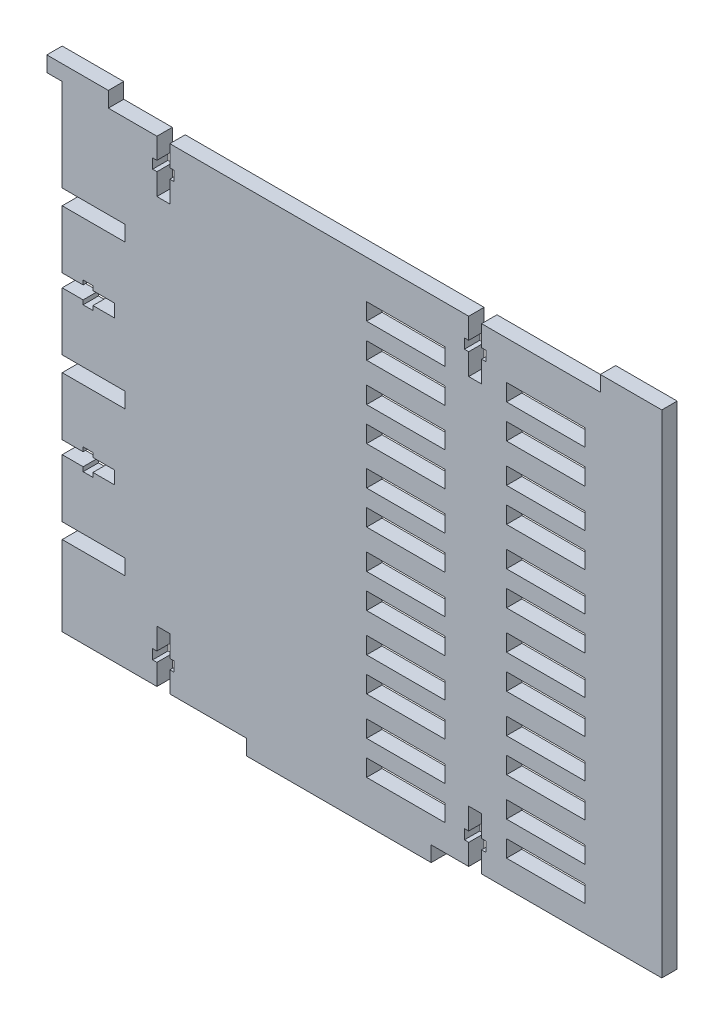
from build123d import *

# Parameters (mm, degrees)
SKETCH1_W           = 25.5
SKETCH1_H           = 5.5
BOSS_EXTRUDE1_DEPTH = 5
CUT_EXTRUDE1_DEPTH  = 10
SKETCH5_W           = 60
SKETCH5_H           = 5
BOSS_EXTRUDE2_DEPTH = 5
SKETCH6_W           = 20.4
SKETCH6_H           = 5
CUT_EXTRUDE2_DEPTH  = 10


with BuildPart() as part:
    # Sketch1 → Boss-Extrude1 (new body)
    with BuildSketch(Plane.XY):
        Polygon((-155, 151.5), (-155, 146.5), (5, 146.5), (5, 151.5), (25, 151.5), (25, -8.5), (-170, -8.5), (-170, 17.5), (-150, 17.5), (-150, 22.5), (-170, 22.5), (-170, 41), (-170, 41.4), (-163.2, 41.4), (-163.2, 40), (-160, 40), (-160, 41.4), (-153, 41.4), (-153, 45.6), (-160, 45.6), (-160, 47), (-163.2, 47), (-163.2, 45.6), (-170, 45.6), (-170, 46), (-170, 64.5), (-150, 64.5), (-150, 69.5), (-170, 69.5), (-170, 88.4), (-163.2, 88.4), (-163.2, 87), (-160, 87), (-160, 88.4), (-153, 88.4), (-153, 92.6), (-160, 92.6), (-160, 94), (-163.2, 94), (-163.2, 92.6), (-170, 92.6), (-170, 111.5), (-150, 111.5), (-150, 116.5), (-170, 116.5), (-170, 146.5), (-175, 146.5), (-175, 151.5), align=None)
        with Locations((-58.25, 13.75)):
            Rectangle(SKETCH1_W, SKETCH1_H, mode=Mode.SUBTRACT)
        with Locations((-12.75, 2.75)):
            Rectangle(SKETCH1_W, SKETCH1_H, mode=Mode.SUBTRACT)
        with Locations((-58.25, 2.75)):
            Rectangle(SKETCH1_W, SKETCH1_H, mode=Mode.SUBTRACT)
        with Locations((-12.75, 13.75)):
            Rectangle(SKETCH1_W, SKETCH1_H, mode=Mode.SUBTRACT)
        with Locations((-12.75, 26.25)):
            Rectangle(SKETCH1_W, SKETCH1_H, mode=Mode.SUBTRACT)
        with Locations((-58.25, 26.25)):
            Rectangle(SKETCH1_W, SKETCH1_H, mode=Mode.SUBTRACT)
        with Locations((-58.25, 37.25)):
            Rectangle(SKETCH1_W, SKETCH1_H, mode=Mode.SUBTRACT)
        with Locations((-12.75, 37.25)):
            Rectangle(SKETCH1_W, SKETCH1_H, mode=Mode.SUBTRACT)
        with Locations((-12.75, 49.75)):
            Rectangle(SKETCH1_W, SKETCH1_H, mode=Mode.SUBTRACT)
        with Locations((-58.25, 49.75)):
            Rectangle(SKETCH1_W, SKETCH1_H, mode=Mode.SUBTRACT)
        with Locations((-58.25, 60.75)):
            Rectangle(SKETCH1_W, SKETCH1_H, mode=Mode.SUBTRACT)
        with Locations((-12.75, 60.75)):
            Rectangle(SKETCH1_W, SKETCH1_H, mode=Mode.SUBTRACT)
        with Locations((-12.75, 73.25)):
            Rectangle(SKETCH1_W, SKETCH1_H, mode=Mode.SUBTRACT)
        with Locations((-58.25, 73.25)):
            Rectangle(SKETCH1_W, SKETCH1_H, mode=Mode.SUBTRACT)
        with Locations((-58.25, 84.25)):
            Rectangle(SKETCH1_W, SKETCH1_H, mode=Mode.SUBTRACT)
        with Locations((-12.75, 84.25)):
            Rectangle(SKETCH1_W, SKETCH1_H, mode=Mode.SUBTRACT)
        with Locations((-12.75, 96.75)):
            Rectangle(SKETCH1_W, SKETCH1_H, mode=Mode.SUBTRACT)
        with Locations((-58.25, 96.75)):
            Rectangle(SKETCH1_W, SKETCH1_H, mode=Mode.SUBTRACT)
        with Locations((-58.25, 107.75)):
            Rectangle(SKETCH1_W, SKETCH1_H, mode=Mode.SUBTRACT)
        with Locations((-12.75, 107.75)):
            Rectangle(SKETCH1_W, SKETCH1_H, mode=Mode.SUBTRACT)
        with Locations((-12.75, 120.25)):
            Rectangle(SKETCH1_W, SKETCH1_H, mode=Mode.SUBTRACT)
        with Locations((-58.25, 120.25)):
            Rectangle(SKETCH1_W, SKETCH1_H, mode=Mode.SUBTRACT)
        with Locations((-58.25, 131.25)):
            Rectangle(SKETCH1_W, SKETCH1_H, mode=Mode.SUBTRACT)
        with Locations((-12.75, 131.25)):
            Rectangle(SKETCH1_W, SKETCH1_H, mode=Mode.SUBTRACT)
    extrude(amount=BOSS_EXTRUDE1_DEPTH)

    # Sketch4 → Cut-Extrude1 (cut)
    with BuildSketch(Plane.XY.offset(5)):
        Polygon((-37.8, 129.5), (-37.8, 136.5), (-39.2, 136.5), (-39.2, 139.7), (-37.8, 139.7), (-37.8, 146.5), (-33.6, 146.5), (-33.6, 139.7), (-32.2, 139.7), (-32.2, 136.5), (-33.6, 136.5), (-33.6, 129.5), align=None)
        Polygon((-139.2, 139.7), (-139.2, 146.5), (-135, 146.5), (-135, 139.7), (-133.6, 139.7), (-133.6, 136.5), (-135, 136.5), (-135, 129.5), (-139.2, 129.5), (-139.2, 136.5), (-140.6, 136.5), (-140.6, 139.7), align=None)
        Polygon((-37.8, -8.5), (-33.6, -8.5), (-33.6, -1.7), (-32.2, -1.7), (-32.2, 1.5), (-33.6, 1.5), (-33.6, 8.5), (-37.8, 8.5), (-37.8, 1.5), (-39.2, 1.5), (-39.2, -1.7), (-37.8, -1.7), align=None)
        Polygon((-139.2, -8.5), (-135, -8.5), (-135, -1.7), (-133.6, -1.7), (-133.6, 1.5), (-135, 1.5), (-135, 8.5), (-139.2, 8.5), (-139.2, 1.5), (-140.6, 1.5), (-140.6, -1.7), (-139.2, -1.7), align=None)
    extrude(amount=-CUT_EXTRUDE1_DEPTH, mode=Mode.SUBTRACT)

    # Sketch5 → Boss-Extrude2 (add)
    with BuildSketch(Plane(origin=(0, 0, 0), x_dir=(-1, 0, 0), z_dir=(0, 0, -1))):
        with Locations((80, -11)):
            Rectangle(SKETCH5_W, SKETCH5_H)
    extrude(amount=-BOSS_EXTRUDE2_DEPTH)

    # Sketch6 → Cut-Extrude2 (cut)
    with BuildSketch(Plane(origin=(0, 0, 0), x_dir=(-1, 0, 0), z_dir=(0, 0, -1))):
        with Locations((159.8, 114)):
            Rectangle(SKETCH6_W, SKETCH6_H)
        with Locations((159.8, 67)):
            Rectangle(SKETCH6_W, SKETCH6_H)
        with Locations((159.8, 20)):
            Rectangle(SKETCH6_W, SKETCH6_H)
    extrude(amount=-CUT_EXTRUDE2_DEPTH, mode=Mode.SUBTRACT)


solid = part.part
